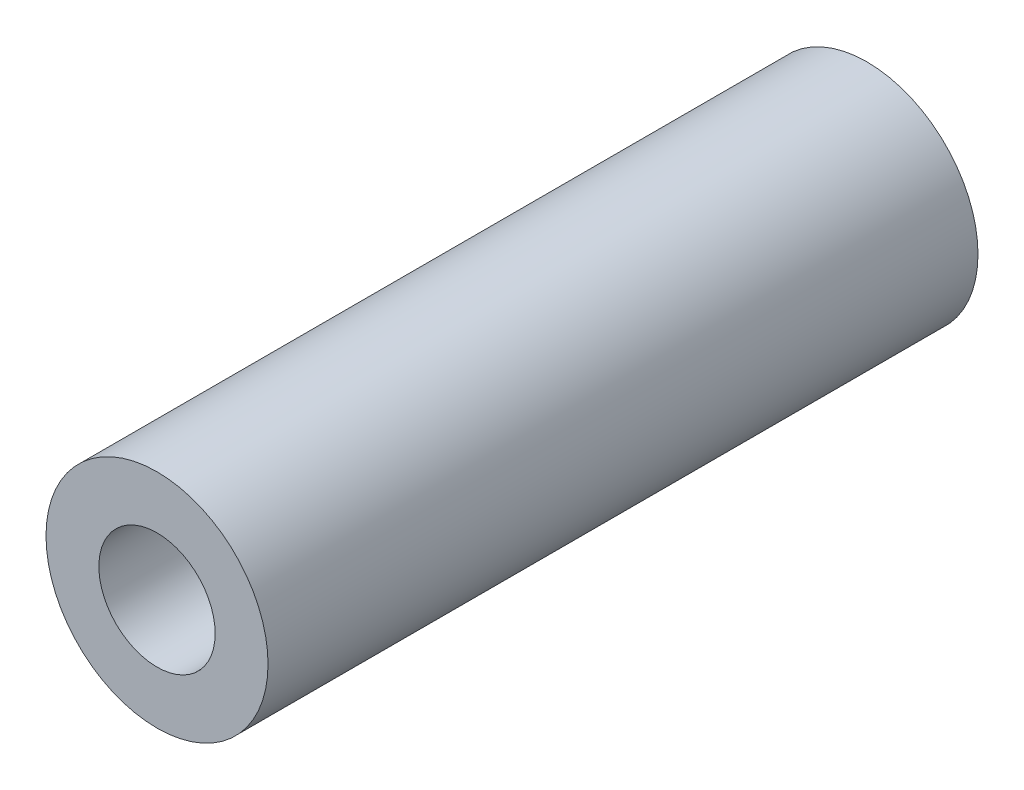
from build123d import *

# Parameters (mm, degrees)
SKETCH1_R           = 2.1
SKETCH1_R_2         = 1.1
BOSS_EXTRUDE1_DEPTH = 13.43


with BuildPart() as part:
    # Sketch1 → Boss-Extrude1 (new body)
    with BuildSketch(Plane.XY):
        Circle(SKETCH1_R)
        Circle(SKETCH1_R_2, mode=Mode.SUBTRACT)
    extrude(amount=BOSS_EXTRUDE1_DEPTH)


solid = part.part
